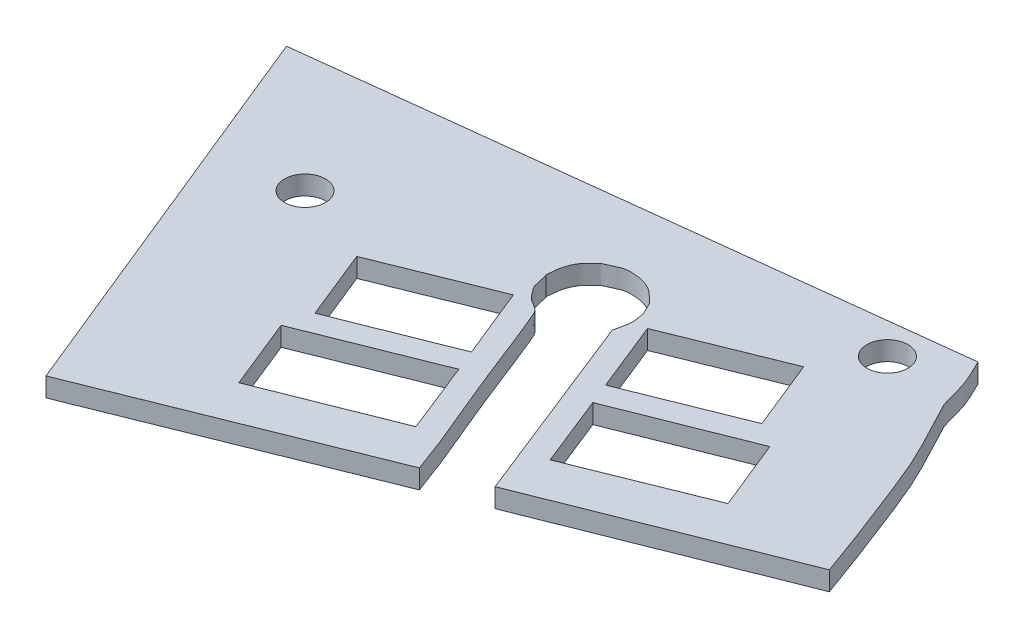
from build123d import *

# Parameters (mm, degrees)
SKETCH1_R           = 1.281558591
SKETCH1_R_2         = 1.27912149
BOSS_EXTRUDE1_DEPTH = 1.19


with BuildPart() as part:
    # Sketch1 → Boss-Extrude1 (new body)
    with BuildSketch(Plane(origin=(0, 0, 0), x_dir=(1, 0, 0), z_dir=(0, 1, 0))):
        with BuildLine():
            Line((-3.948168159, 25.857752235), (34.708440024, 30.372559307))
            add(Edge.make_bspline(
                [(34.708440024, 30.372559307), (34.942308086, 29.862573914), (35.216465801, 29.369202379), (35.41004421, 28.842603127), (35.634944676, 28.230797202), (35.768879722, 27.589205916), (35.960617271, 26.966210393), (35.965938184, 26.948921629), (35.991057299, 26.944232956), (35.999261802, 26.928111554), (36.743885485, 25.464966639), (37.564180772, 24.036910168), (38.217825185, 22.530919978), (38.865327395, 21.039081363), (40.441376905, 16.960362547), (41.306486039, 14.494420913)],
                knots=[0, 0, 0, 0, 1, 1, 1, 2, 2, 2, 3, 3, 3, 4, 4, 4, 5, 5, 5, 5], degree=3))
            Line((41.306486039, 14.494420913), (26.379308433, 8.556241677))
            Line((26.379308433, 8.556241677), (21.571141955, 20.672821201))
            add(Edge.make_bspline(
                [(21.571141955, 20.672821201), (21.634910972, 21.018173468), (21.748594484, 21.35796102), (21.762449005, 21.708878001), (21.774151999, 22.005299603), (21.695806289, 22.298709609), (21.646885264, 22.591300552), (21.643902496, 22.609140136), (21.617478501, 22.613950002), (21.608496587, 22.629649458), (21.454882222, 22.898151457), (21.383454938, 23.23493464), (21.147653492, 23.435155456), (20.905488639, 23.64077949), (20.692579942, 23.888331524), (20.418328284, 24.048678297), (20.15986613, 24.199793417), (19.870796872, 24.315401802), (19.574055785, 24.355191149), (19.180278137, 24.407991911), (18.74328259, 24.448836406), (18.384663016, 24.277837116), (18.13147516, 24.157110455), (17.87065401, 24.052846943), (17.617466154, 23.932120282), (17.601139945, 23.924335514), (17.591549832, 23.906868519), (17.579117247, 23.893731605), (17.361458227, 23.66374179), (17.104351703, 23.465224478), (16.927205729, 23.202755302), (16.779704543, 22.984209467), (16.687302856, 22.728685321), (16.62063322, 22.473589178), (16.545622255, 22.186576842), (16.544200548, 21.885227936), (16.505984212, 21.591047315)],
                knots=[0, 0, 0, 0, 1, 1, 1, 2, 2, 2, 3, 3, 3, 4, 4, 4, 5, 5, 5, 6, 6, 6, 7, 7, 7, 8, 8, 8, 9, 9, 9, 10, 10, 10, 11, 11, 11, 12, 12, 12, 12], degree=3))
            add(Edge.make_bspline(
                [(16.505984212, 21.591047315), (16.518782353, 21.578266264), (16.539801332, 21.570202619), (16.544378636, 21.552704162), (16.617400623, 21.273550308), (16.663764579, 20.987872856), (16.736786566, 20.708719002), (16.806805853, 20.441044093), (17.044044502, 20.24849863), (17.19767347, 20.018388445), (17.465578341, 19.617112304), (18.031163484, 19.577799481), (18.234246012, 19.098229697), (19.127510948, 16.988826809), (19.346682772, 16.331345691), (20.002158395, 14.686998305), (21.518894597, 10.882064728), (22.011547535, 9.986611514), (22.99992287, 7.207084206)],
                knots=[0, 0, 0, 0, 1, 1, 1, 2, 2, 2, 3, 3, 3, 4, 4, 4, 5, 5, 5, 6, 6, 6, 6], degree=3))
            Line((22.99992287, 7.207084206), (6.371709484, 0.524718752))
            Line((6.371709484, 0.524718752), (-3.948168159, 25.857752235))
        make_face()
        with Locations(Location((31.581994118, 27.844041808, 0), (0, 0, 270))):
            Circle(SKETCH1_R, mode=Mode.SUBTRACT)
        with Locations(Location((4.443945521, 18.622159212, 0), (0, 0, 270))):
            Circle(SKETCH1_R_2, mode=Mode.SUBTRACT)
        Polygon((29.528011628, 24.668032897), (31.295389474, 20.292362952), (24.334912298, 17.497443293), (22.582661714, 21.866014987), align=None, mode=Mode.SUBTRACT)
        Polygon((16.577782643, 19.493154262), (18.362295388, 15.097963812), (11.376540447, 12.313291502), (9.611482192, 16.686576517), align=None, mode=Mode.SUBTRACT)
        Polygon((32.786623967, 19.298845197), (34.559807218, 14.90935059), (26.647925888, 11.722355727), (24.882600183, 16.153609635), align=None, mode=Mode.SUBTRACT)
        Polygon((18.898363139, 13.77263465), (20.661300607, 9.324417197), (12.759882633, 6.178035225), (10.974286829, 10.601867258), align=None, mode=Mode.SUBTRACT)
    extrude(amount=BOSS_EXTRUDE1_DEPTH)


solid = part.part
